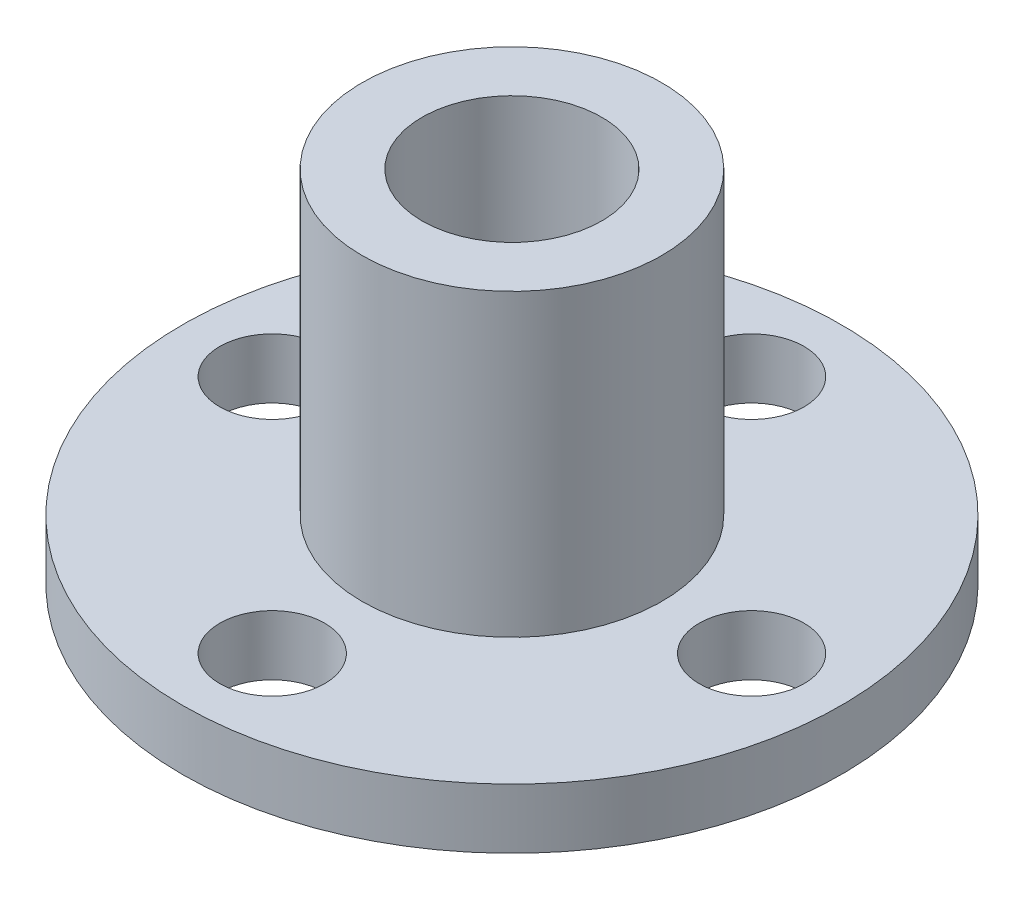
from build123d import *

# Parameters (mm, degrees)
CROQUIS1_R              = 11
CROQUIS1_R_2            = 4
SALIENTE_EXTRUIR1_DEPTH = 2
CROQUIS2_R              = 5
CROQUIS2_R_2            = 3
SALIENTE_EXTRUIR2_DEPTH = 10
CROQUIS3_R              = 1.75
CORTAR_EXTRUIR1_DEPTH   = 10


with BuildPart() as part:
    # Croquis1 → Saliente-Extruir1 (new body)
    with BuildSketch(Plane(origin=(0, 0, 0), x_dir=(1, 0, 0), z_dir=(0, 1, 0))):
        with Locations(Location((0, 0, 0), (0, 0, 270))):
            Circle(CROQUIS1_R)
        with Locations(Location((0, 0, 0), (0, 0, 270))):
            Circle(CROQUIS1_R_2, mode=Mode.SUBTRACT)
    extrude(amount=SALIENTE_EXTRUIR1_DEPTH)

    # Croquis2 → Saliente-Extruir2 (add)
    with BuildSketch(Plane(origin=(0, 2, 0), x_dir=(1, 0, 0), z_dir=(0, 1, 0))):
        with Locations(Location((0, 0, 0), (0, 0, 270))):
            Circle(CROQUIS2_R)
        with Locations(Location((0, 0, 0), (0, 0, 270))):
            Circle(CROQUIS2_R_2, mode=Mode.SUBTRACT)
    extrude(amount=SALIENTE_EXTRUIR2_DEPTH)

    # Croquis3 → Cortar-Extruir1 (cut)
    with BuildSketch(Plane.XZ):
        with Locations(Location((0, 8, 0), (0, 0, 270))):
            Circle(CROQUIS3_R)
        with Locations(Location((8, 0, 0), (0, 0, 270))):
            Circle(CROQUIS3_R)
        with Locations(Location((-8, 0, 0), (0, 0, 270))):
            Circle(CROQUIS3_R)
        with Locations(Location((0, -8, 0), (0, 0, 270))):
            Circle(CROQUIS3_R)
    extrude(amount=-CORTAR_EXTRUIR1_DEPTH, mode=Mode.SUBTRACT)


solid = part.part
